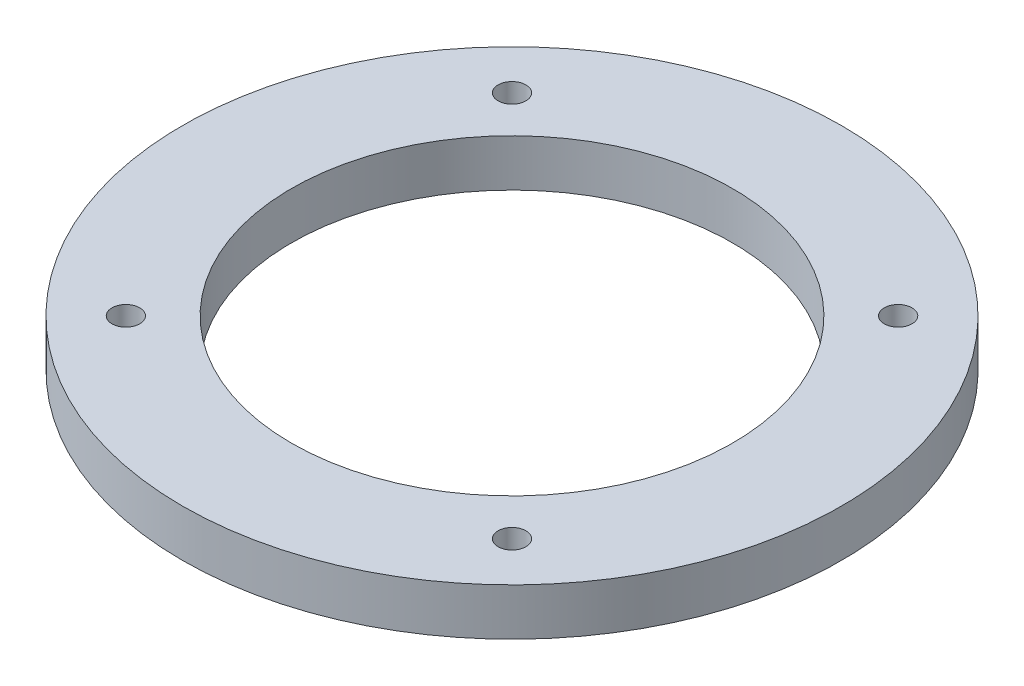
from build123d import *

# Parameters (mm, degrees)
SKETCH1_R           = 35
SKETCH1_R_2         = 23.425
SKETCH1_R_3         = 1.475
BOSS_EXTRUDE1_DEPTH = 2.5


with BuildPart() as part:
    # Sketch1 → Boss-Extrude1 (new, symmetric)
    with BuildSketch(Plane(origin=(0, 0, 0), x_dir=(1, 0, 0), z_dir=(0, 1, 0))):
        with Locations(Location((0, 0, 0), (0, 0, 270))):
            Circle(SKETCH1_R)
        with Locations(Location((0, 0, 0), (0, 0, 270))):
            Circle(SKETCH1_R_2, mode=Mode.SUBTRACT)
        with Locations(Location((-20.505, 20.505, 0), (0, 0, 270))):
            Circle(SKETCH1_R_3, mode=Mode.SUBTRACT)
        with Locations(Location((20.505, 20.505, 0), (0, 0, 90))):
            Circle(SKETCH1_R_3, mode=Mode.SUBTRACT)
        with Locations(Location((20.505, -20.505, 0), (0, 0, 270))):
            Circle(SKETCH1_R_3, mode=Mode.SUBTRACT)
        with Locations(Location((-20.505, -20.505, 0), (0, 0, 90))):
            Circle(SKETCH1_R_3, mode=Mode.SUBTRACT)
    extrude(amount=BOSS_EXTRUDE1_DEPTH, both=True)


solid = part.part
